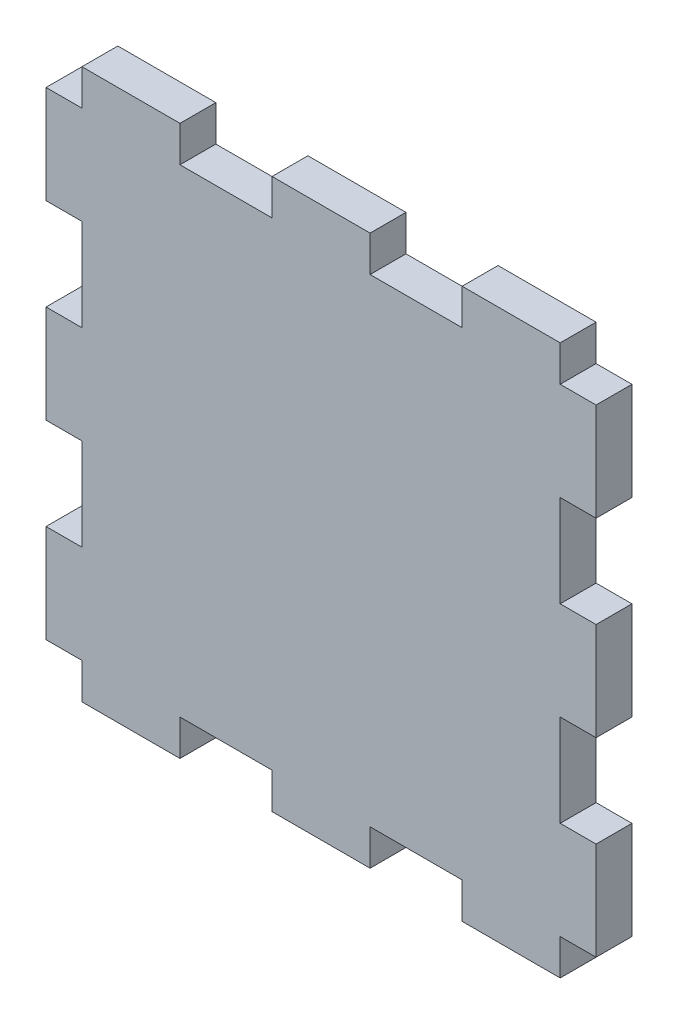
from build123d import *

# Parameters (mm, degrees)
CROQUIS1_W              = 3
CROQUIS1_H              = 8.2
CROQUIS1_W_2            = 8.2
CROQUIS1_H_2            = 3.00257915
CROQUIS1_W_3            = 40
CROQUIS1_H_3            = 40
SALIENTE_EXTRUIR1_DEPTH = 3


with BuildPart() as part:
    # Croquis1 → Saliente-Extruir1 (new body)
    with BuildSketch(Plane.XY):
        with Locations((-21.5, 15.9)):
            Rectangle(CROQUIS1_W, CROQUIS1_H)
        with Locations((-15.9, 21.501289575)):
            Rectangle(CROQUIS1_W_2, CROQUIS1_H_2)
        with Locations((0, 21.501289575)):
            Rectangle(CROQUIS1_W_2, CROQUIS1_H_2)
        with Locations((15.9, 21.501289575)):
            Rectangle(CROQUIS1_W_2, CROQUIS1_H_2)
        Rectangle(CROQUIS1_W_3, CROQUIS1_H_3)
        with Locations((21.5, 0)):
            Rectangle(CROQUIS1_W, CROQUIS1_H)
        with Locations((-21.5, 0)):
            Rectangle(CROQUIS1_W, CROQUIS1_H)
        with Locations((-21.5, -15.9)):
            Rectangle(CROQUIS1_W, CROQUIS1_H)
        with Locations((-15.9, -21.501289575)):
            Rectangle(CROQUIS1_W_2, CROQUIS1_H_2)
        with Locations((0, -21.501289575)):
            Rectangle(CROQUIS1_W_2, CROQUIS1_H_2)
        with Locations((15.9, -21.501289575)):
            Rectangle(CROQUIS1_W_2, CROQUIS1_H_2)
        with Locations((21.5, -15.9)):
            Rectangle(CROQUIS1_W, CROQUIS1_H)
        with Locations((21.5, 15.9)):
            Rectangle(CROQUIS1_W, CROQUIS1_H)
    extrude(amount=SALIENTE_EXTRUIR1_DEPTH)


solid = part.part
